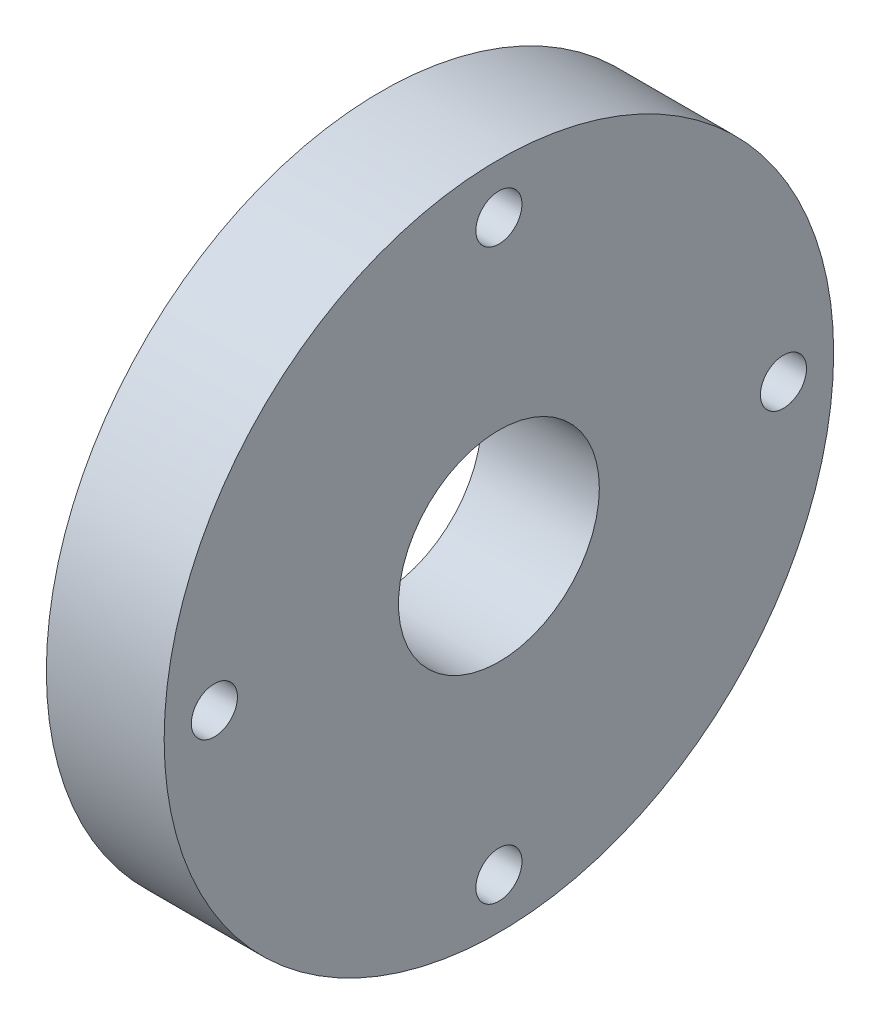
from build123d import *

# Parameters (mm, degrees)
SKETCH1_R           = 63.5
BOSS_EXTRUDE1_DEPTH = 22.352
SKETCH2_R           = 19.05
CUT_EXTRUDE2_DEPTH  = 93.542487021
SKETCH3_R           = 4.3688
CUT_EXTRUDE4_DEPTH  = 93.542487021
SKETCH4_R           = 6.7437
CUT_EXTRUDE5_DEPTH  = 9.652


with BuildPart() as part:
    # Sketch1 → Boss-Extrude1 (new body)
    with BuildSketch(Plane.YZ):
        with Locations(Location((0, 0, 0), (0, 0, 270))):
            Circle(SKETCH1_R)
    extrude(amount=BOSS_EXTRUDE1_DEPTH)

    # Sketch2 → Cut-Extrude2 (cut, through all)
    with BuildSketch(Plane.YZ):
        with Locations(Location((0, 0, 0), (0, 0, 270))):
            Circle(SKETCH2_R)
    extrude(amount=CUT_EXTRUDE2_DEPTH, mode=Mode.SUBTRACT)

    # Sketch3 → Cut-Extrude4 (cut, through all)
    with BuildSketch(Plane.YZ):
        with Locations(Location((53.975, 0, 0), (0, 0, 270))):
            Circle(SKETCH3_R)
        with Locations(Location((0, 53.975, 0), (0, 0, 270))):
            Circle(SKETCH3_R)
        with Locations(Location((-53.975, 0, 0), (0, 0, 270))):
            Circle(SKETCH3_R)
        with Locations(Location((0, -53.975, 0), (0, 0, 270))):
            Circle(SKETCH3_R)
    extrude(amount=CUT_EXTRUDE4_DEPTH, mode=Mode.SUBTRACT)

    # Sketch4 → Cut-Extrude5 (cut)
    with BuildSketch(Plane.YZ):
        with Locations(Location((53.975, 0, 0), (0, 0, 270))):
            Circle(SKETCH4_R)
        with Locations(Location((0, 53.975, 0), (0, 0, 270))):
            Circle(SKETCH4_R)
        with Locations(Location((-53.975, 0, 0), (0, 0, 270))):
            Circle(SKETCH4_R)
        with Locations(Location((0, -53.975, 0), (0, 0, 270))):
            Circle(SKETCH4_R)
    extrude(amount=CUT_EXTRUDE5_DEPTH, mode=Mode.SUBTRACT)


solid = part.part
